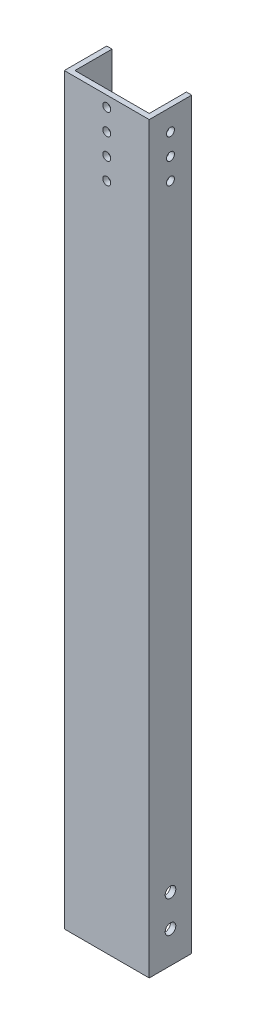
from build123d import *

# Parameters (mm, degrees)
BOSS_EXTRUDE1_DEPTH = 444.5
SKETCH2_R           = 3.175
SKETCH2_R_2         = 2.38125
CUT_EXTRUDE1_DEPTH  = 449.113880615
SKETCH3_R           = 2.38125
CUT_EXTRUDE2_DEPTH  = 449.113880615


with BuildPart() as part:
    # Sketch1 → Boss-Extrude1 (new body)
    with BuildSketch(Plane(origin=(0, 0, 0), x_dir=(1, 0, 0), z_dir=(0, 1, 0))):
        Polygon((0, 0), (50.8, 0), (50.8, 25.4), (47.625, 25.4), (47.625, 3.175), (3.175, 3.175), (3.175, 25.4), (0, 25.4), align=None)
    extrude(amount=BOSS_EXTRUDE1_DEPTH)

    # Sketch2 → Cut-Extrude1 (cut, through all)
    with BuildSketch(Plane(origin=(50.8, 0, 0), x_dir=(0, 0, -1), z_dir=(1, 0, 0))):
        with Locations((12.7, 38.1)):
            Circle(SKETCH2_R)
        with Locations((12.7, 19.05)):
            Circle(SKETCH2_R)
        with Locations((12.7, 406.4)):
            Circle(SKETCH2_R_2)
        with Locations((12.7, 419.1)):
            Circle(SKETCH2_R_2)
        with Locations((12.7, 431.8)):
            Circle(SKETCH2_R_2)
    extrude(amount=-CUT_EXTRUDE1_DEPTH, mode=Mode.SUBTRACT)

    # Sketch3 → Cut-Extrude2 (cut, through all)
    with BuildSketch(Plane.XY):
        with Locations((25.4, 438.15)):
            Circle(SKETCH3_R)
        with Locations((25.4, 425.45)):
            Circle(SKETCH3_R)
        with Locations((25.4, 412.75)):
            Circle(SKETCH3_R)
        with Locations((25.4, 400.05)):
            Circle(SKETCH3_R)
    extrude(amount=-CUT_EXTRUDE2_DEPTH, mode=Mode.SUBTRACT)


solid = part.part
